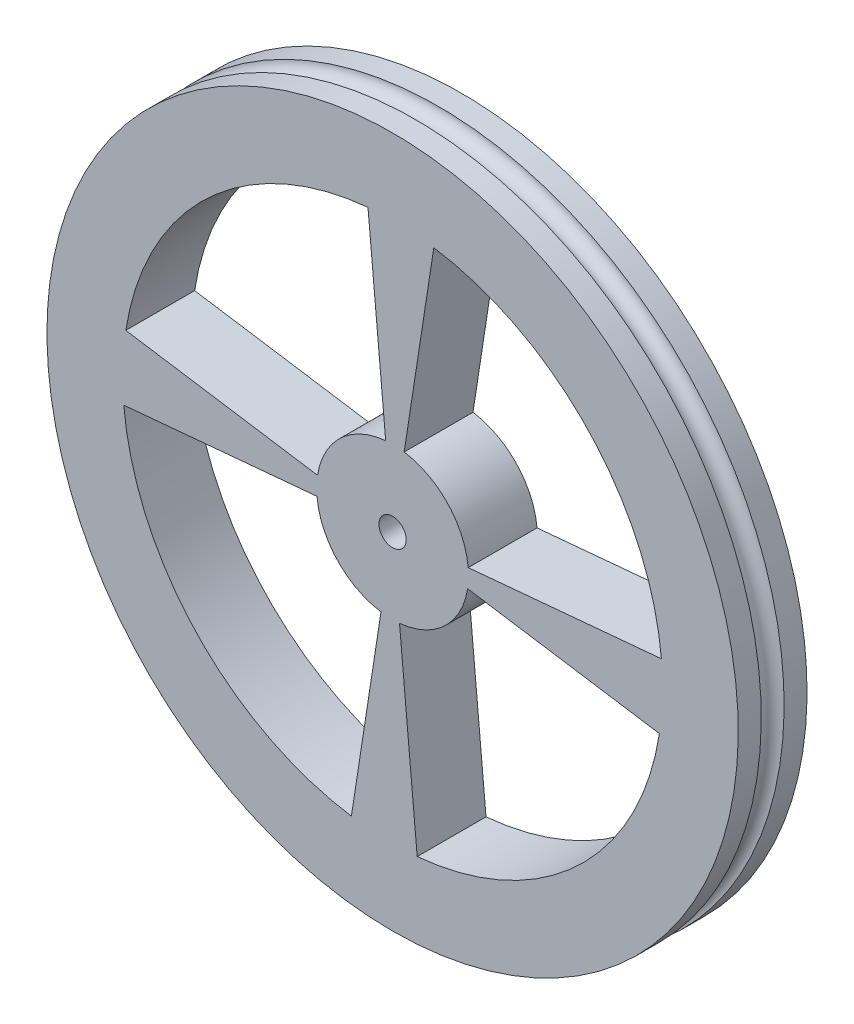
from build123d import *

# Parameters (mm, degrees)
SKETCH5_R          = 2.1
CUT_EXTRUDE1_DEPTH = 120.743736371
CUT_EXTRUDE2_DEPTH = 120.743736371


with BuildPart() as part:
    # Sketch3 → Revolve1 (revolve)
    with BuildSketch(Plane(origin=(0, 0, 0), x_dir=(0, 0, -1), z_dir=(1, 0, 0))):
        with BuildLine():
            Line((0, 0), (0, 53.34))
            Line((0, 53.34), (10.62, 53.34))
            Line((10.62, 53.34), (10.62, 0))
            Line((10.62, 0), (7.08, 0))
            ThreePointArc((7.08, 0), (5.3147, 1.7653), (3.5494, 0))
            Line((3.5494, 0), (0, 0))
        make_face()
    revolve(axis=Axis((0, 53.34, 0), (0, 0, -1)))

    # Sketch5 → Cut-Extrude1 (cut, through all)
    with BuildSketch(Plane.XY):
        with Locations((0, 53.34)):
            Circle(SKETCH5_R)
    extrude(amount=-CUT_EXTRUDE1_DEPTH, mode=Mode.SUBTRACT)

    # Sketch6 → Cut-Extrude2 (cut, through all)
    with BuildSketch(Plane.XY):
        with BuildLine():
            Line((6.358903838, 94.508420539), (1.788715657, 64.920391883))
            ThreePointArc((1.788715657, 64.920391883), (8.538481175, 61.364918635), (11.668962152, 54.407849322))
            Line((11.668962152, 54.407849322), (41.483288818, 57.136216085))
            ThreePointArc((41.483288818, 57.136216085), (30.354394508, 81.868674027), (6.358903838, 94.508420539))
        make_face()
        with BuildLine():
            Line((41.168420539, 46.981096162), (11.580391883, 51.551284343))
            ThreePointArc((11.580391883, 51.551284343), (8.024918635, 44.801518825), (1.067849322, 41.671037848))
            Line((1.067849322, 41.671037848), (3.796216085, 11.856711182))
            ThreePointArc((3.796216085, 11.856711182), (28.528674027, 22.985605492), (41.168420539, 46.981096162))
        make_face()
        with BuildLine():
            Line((-6.358903838, 12.171579461), (-1.788715657, 41.759608117))
            ThreePointArc((-1.788715657, 41.759608117), (-8.538481175, 45.315081365), (-11.668962152, 52.272150678))
            Line((-11.668962152, 52.272150678), (-41.483288818, 49.543783915))
            ThreePointArc((-41.483288818, 49.543783915), (-30.354394508, 24.811325973), (-6.358903838, 12.171579461))
        make_face()
        with BuildLine():
            Line((-41.168420539, 59.698903838), (-11.580391883, 55.128715657))
            ThreePointArc((-11.580391883, 55.128715657), (-8.024918635, 61.878481175), (-1.067849322, 65.008962152))
            Line((-1.067849322, 65.008962152), (-3.796216085, 94.823288818))
            ThreePointArc((-3.796216085, 94.823288818), (-28.528674027, 83.694394508), (-41.168420539, 59.698903838))
        make_face()
    extrude(amount=-CUT_EXTRUDE2_DEPTH, mode=Mode.SUBTRACT)


solid = part.part
